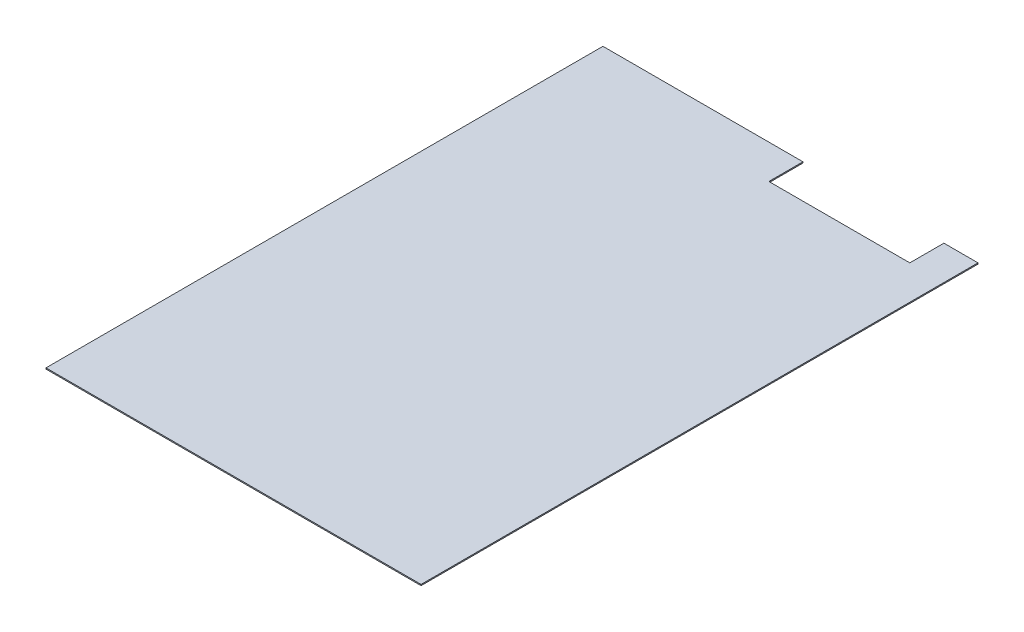
from build123d import *

# Parameters (mm, degrees)
SKETCH1_W           = 165
SKETCH1_H           = 245
BOSS_EXTRUDE1_DEPTH = 0.5
SKETCH2_W           = 62
SKETCH2_H           = 15
CUT_EXTRUDE1_DEPTH  = 10


with BuildPart() as part:
    # Sketch1 → Boss-Extrude1 (new body)
    with BuildSketch(Plane(origin=(0, 0, 0), x_dir=(1, 0, 0), z_dir=(0, 1, 0))):
        Rectangle(SKETCH1_W, SKETCH1_H)
    extrude(amount=BOSS_EXTRUDE1_DEPTH)

    # Sketch2 → Cut-Extrude1 (cut)
    with BuildSketch(Plane.XZ):
        with Locations((36.5, -115)):
            Rectangle(SKETCH2_W, SKETCH2_H)
    extrude(amount=-CUT_EXTRUDE1_DEPTH, mode=Mode.SUBTRACT)


solid = part.part
